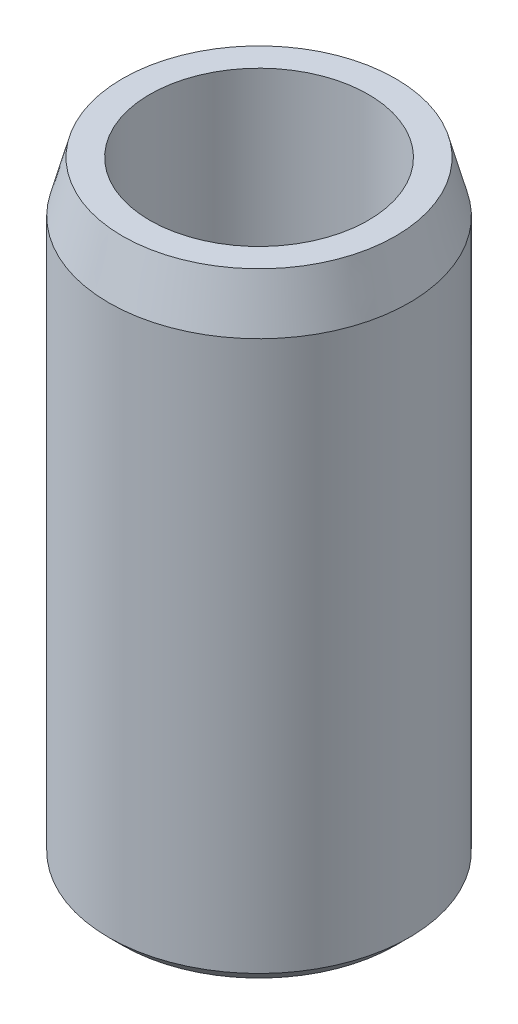
from build123d import *

# Parameters (mm, degrees)
SKETCH1_R           = 22
SKETCH1_R_2         = 16
BOSS_EXTRUDE1_DEPTH = 90
CHAMFER1_SIZE       = 2
CHAMFER1_SIZE2      = 7.464101615
CHAMFER2_SIZE       = 2


with BuildPart() as part:
    # Sketch1 → Boss-Extrude1 (new body)
    with BuildSketch(Plane(origin=(0, 0, 0), x_dir=(1, 0, 0), z_dir=(0, 1, 0))):
        with Locations(Location((0, 0, 0), (0, 0, 270))):
            Circle(SKETCH1_R)
        with Locations(Location((0, 0, 0), (0, 0, 270))):
            Circle(SKETCH1_R_2, mode=Mode.SUBTRACT)
    extrude(amount=-BOSS_EXTRUDE1_DEPTH)

    # Chamfer1
    chamfer1_edges = [part.edges().sort_by_distance(p)[0] for p in [
        (0, 0, -22),
    ]]
    chamfer1_side = [part.faces().sort_by_distance(p)[0] for p in [
        (0, 0, -21.377746033),
    ]]
    chamfer(chamfer1_edges, length=CHAMFER1_SIZE, length2=CHAMFER1_SIZE2, reference=chamfer1_side[0])

    # Chamfer2
    chamfer2_edges = [part.edges().sort_by_distance(p)[0] for p in [
        (0, -90, -22),
    ]]
    chamfer(chamfer2_edges, length=CHAMFER2_SIZE)


solid = part.part
